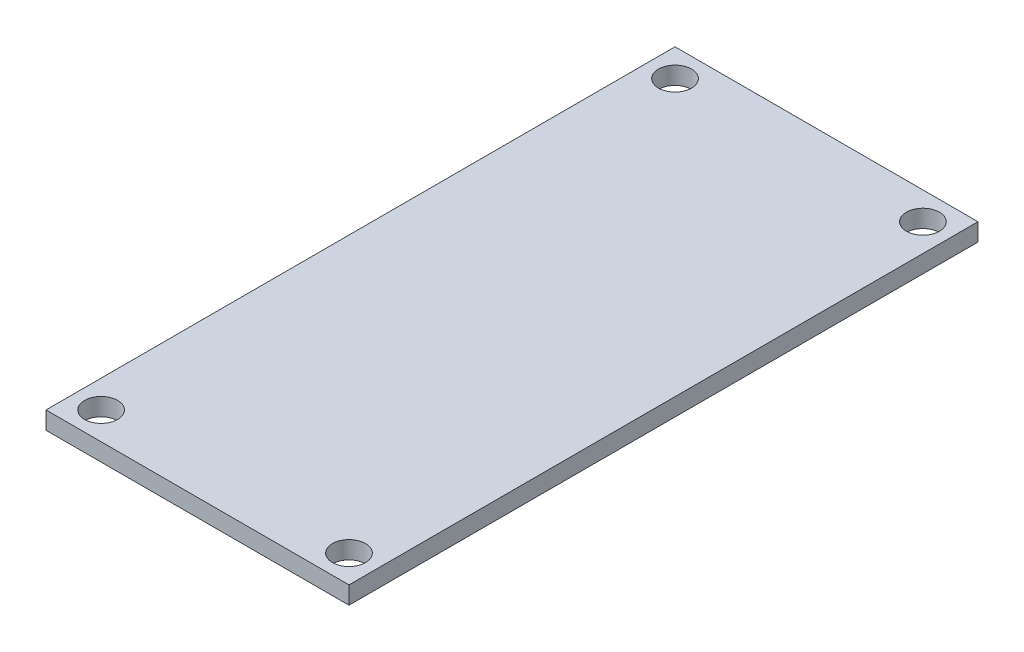
from build123d import *

# Parameters (mm, degrees)
SKETCH1_W           = 27.5
SKETCH1_H           = 57.09
SKETCH1_R           = 1.5
BOSS_EXTRUDE1_DEPTH = 1.6


with BuildPart() as part:
    # Sketch1 → Boss-Extrude1 (new body)
    with BuildSketch(Plane(origin=(0, 0, 0), x_dir=(1, 0, 0), z_dir=(0, 1, 0))):
        Rectangle(SKETCH1_W, SKETCH1_H)
        with Locations(Location((-11.25, 26.045, 0), (0, 0, 270))):
            Circle(SKETCH1_R, mode=Mode.SUBTRACT)
        with Locations(Location((-11.25, -26.045, 0), (0, 0, 90))):
            Circle(SKETCH1_R, mode=Mode.SUBTRACT)
        with Locations(Location((11.25, 26.045, 0), (0, 0, 90))):
            Circle(SKETCH1_R, mode=Mode.SUBTRACT)
        with Locations(Location((11.25, -26.045, 0), (0, 0, 270))):
            Circle(SKETCH1_R, mode=Mode.SUBTRACT)
    extrude(amount=BOSS_EXTRUDE1_DEPTH)


solid = part.part
